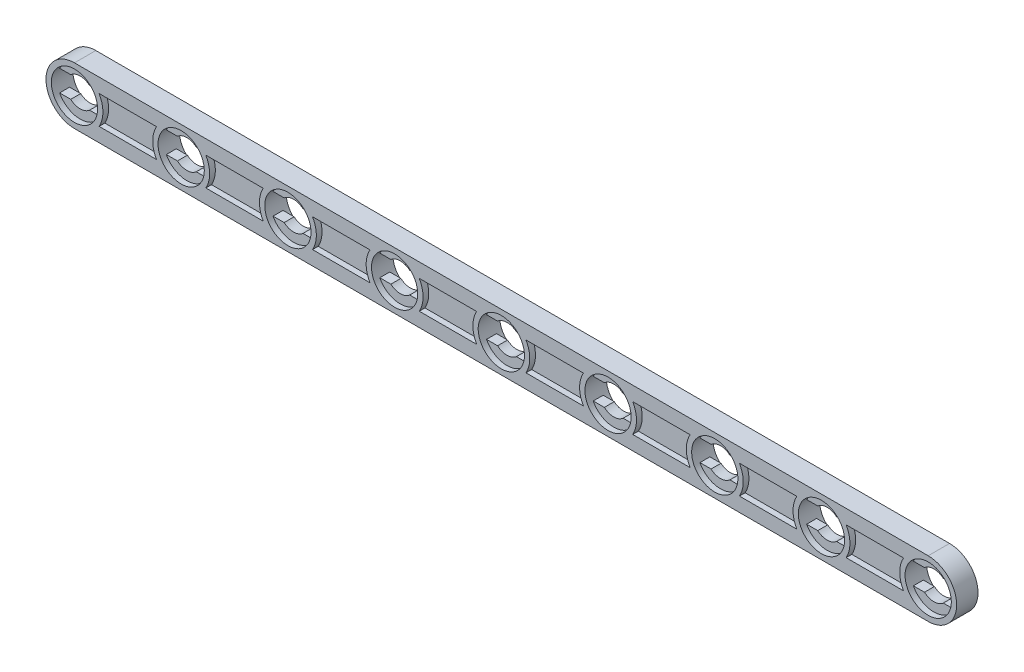
from build123d import *

# Parameters (mm, degrees)
EXTRUDE_1_DEPTH           = 3
CUT_EXTRUDE_1_REACH       = 126.101
SKETCH_3_R                = 3.25
CUT_EXTRUDE_2_DEPTH       = 0.8
CUT_EXTRUDE_START         = -2.2
SKETCH_3_2_R              = 3.25
CUT_EXTRUDE_3_DEPTH       = 0.8
CUT_EXTRUDE_4_DEPTH       = 0.8
SKETCH_5_W                = 7
SKETCH_5_H                = 4
CUT_EXTRUDE_6_DEPTH       = 0.8
MIRROR_8_COPY_1_REACH     = 126.101
MIRROR_8_COPY_2_SKETCH_R  = 3.25
MIRROR_8_COPY_2_DEPTH     = 0.8
MIRROR_START              = -2.2
MIRROR_8_COPY_3_SKETCH_R  = 3.25
MIRROR_8_COPY_3_DEPTH     = 0.8
MIRROR_8_COPY_4_DEPTH     = 0.8
MIRROR_8_COPY_5_SKETCH_W  = 7
MIRROR_8_COPY_5_SKETCH_H  = 4
MIRROR_8_COPY_5_DEPTH     = 0.8
MIRROR_8_COPY_6_REACH     = 126.101
MIRROR_8_COPY_7_SKETCH_R  = 3.25
MIRROR_8_COPY_7_DEPTH     = 0.8
MIRROR_8_COPY_8_SKETCH_R  = 3.25
MIRROR_8_COPY_8_DEPTH     = 0.8
MIRROR_10_COPY_1_REACH    = 126.101
MIRROR_10_COPY_2_SKETCH_R = 3.25
MIRROR_10_COPY_2_DEPTH    = 0.8
MIRROR_10_COPY_3_SKETCH_R = 3.25
MIRROR_10_COPY_3_DEPTH    = 0.8
MIRROR_10_COPY_4_DEPTH    = 0.8
MIRROR_10_COPY_5_SKETCH_W = 7
MIRROR_10_COPY_5_SKETCH_H = 4
MIRROR_10_COPY_5_DEPTH    = 0.8


with BuildPart() as part:
    # 草图1 → 凸台-拉伸1 (new body)
    with BuildSketch(Plane.XY):
        with BuildLine():
            Line((0, 4), (120, 4))
            ThreePointArc((120, 4), (124, 0), (120, -4))
            Line((120, -4), (0, -4))
            ThreePointArc((0, -4), (-4, 0), (0, 4))
        make_face()
    extrude(amount=-EXTRUDE_1_DEPTH)

    # 草图2 → 切除-拉伸1 (cut, up to next)
    with BuildSketch(Plane.XY, mode=Mode.PRIVATE) as cut_extrude_1_sk1:
        with BuildLine():
            Line((1.322875656, -1.5), (2.883140649, -1.5))
            ThreePointArc((2.883140649, -1.5), (3.25, 0), (2.883140649, 1.5))
            Line((2.883140649, 1.5), (1.322875656, 1.5))
            ThreePointArc((1.322875656, 1.5), (0, 2), (-1.322875656, 1.5))
            Line((-1.322875656, 1.5), (-2.883140649, 1.5))
            ThreePointArc((-2.883140649, 1.5), (-3.25, 0), (-2.883140649, -1.5))
            Line((-2.883140649, -1.5), (-1.322875656, -1.5))
            ThreePointArc((-1.322875656, -1.5), (0, -2), (1.322875656, -1.5))
        make_face()
    cut_extrude_1_tool1 = extrude(cut_extrude_1_sk1.sketch, amount=-CUT_EXTRUDE_1_REACH, mode=Mode.PRIVATE) & part.part
    cut_extrude_1 = cut_extrude_1_tool1.solids().sort_by_distance((0, 0, 0))[0]
    add(cut_extrude_1, mode=Mode.SUBTRACT)

    # 草图3 → 切除-拉伸2 (cut)
    with BuildSketch(Plane.XY):
        Circle(SKETCH_3_R)
    cut_extrude_2 = extrude(amount=-CUT_EXTRUDE_2_DEPTH, mode=Mode.SUBTRACT)

    # 草图3<2> → 切除-拉伸3 (cut)
    with BuildSketch(Plane.XY.offset(CUT_EXTRUDE_START)):
        Circle(SKETCH_3_2_R)
    cut_extrude_3 = extrude(amount=-CUT_EXTRUDE_3_DEPTH, mode=Mode.SUBTRACT)

    # 草图4 → 切除-拉伸4 (cut)
    with BuildSketch(Plane.XY):
        with BuildLine():
            Line((3.464101615, 2), (11.535898385, 2))
            ThreePointArc((11.535898385, 2), (11, 0), (11.535898385, -2))
            Line((11.535898385, -2), (3.464101615, -2))
            ThreePointArc((3.464101615, -2), (4, 0), (3.464101615, 2))
        make_face()
    cut_extrude_4 = extrude(amount=-CUT_EXTRUDE_4_DEPTH, mode=Mode.SUBTRACT)

    # 草图5 → 切除-拉伸6 (cut)
    with BuildSketch(Plane(origin=(0, 0, -3), x_dir=(-1, 0, 0), z_dir=(0, 0, -1))):
        with Locations((-7.5, 0)):
            Rectangle(SKETCH_5_W, SKETCH_5_H)
    cut_extrude_6 = extrude(amount=-CUT_EXTRUDE_6_DEPTH, mode=Mode.SUBTRACT)

    # 镜向1: 切除-拉伸1, 切除-拉伸2, 切除-拉伸3 across plane
    add(cut_extrude_1.mirror(Plane(origin=(7.5, 0, 0), x_dir=(0, 0, 1), z_dir=(1, 0, 0))), mode=Mode.SUBTRACT)
    add(cut_extrude_2.mirror(Plane(origin=(7.5, 0, 0), x_dir=(0, 0, 1), z_dir=(1, 0, 0))), mode=Mode.SUBTRACT)
    add(cut_extrude_3.mirror(Plane(origin=(7.5, 0, 0), x_dir=(0, 0, 1), z_dir=(1, 0, 0))), mode=Mode.SUBTRACT)

    # 镜向3: 切除-拉伸4, 切除-拉伸6 across plane
    add(cut_extrude_4.mirror(Plane(origin=(15, 0, 0), x_dir=(0, 0, 1), z_dir=(1, 0, 0))), mode=Mode.SUBTRACT)
    add(cut_extrude_6.mirror(Plane(origin=(15, 0, 0), x_dir=(0, 0, 1), z_dir=(1, 0, 0))), mode=Mode.SUBTRACT)

    # 镜向4: 切除-拉伸4, 切除-拉伸6 across plane
    add(cut_extrude_4.mirror(Plane(origin=(22.5, 0, 0), x_dir=(0, 0, 1), z_dir=(1, 0, 0))), mode=Mode.SUBTRACT)
    add(cut_extrude_6.mirror(Plane(origin=(22.5, 0, 0), x_dir=(0, 0, 1), z_dir=(1, 0, 0))), mode=Mode.SUBTRACT)

    # 镜向7: 切除-拉伸1, 切除-拉伸2, 切除-拉伸3 across plane
    add(cut_extrude_1.mirror(Plane(origin=(15, 0, 0), x_dir=(0, 0, 1), z_dir=(1, 0, 0))), mode=Mode.SUBTRACT)
    add(cut_extrude_2.mirror(Plane(origin=(15, 0, 0), x_dir=(0, 0, 1), z_dir=(1, 0, 0))), mode=Mode.SUBTRACT)
    add(cut_extrude_3.mirror(Plane(origin=(15, 0, 0), x_dir=(0, 0, 1), z_dir=(1, 0, 0))), mode=Mode.SUBTRACT)

    # 镜向8: 切除-拉伸1, 切除-拉伸2, 切除-拉伸3, 切除-拉伸4, 切除-拉伸6 across plane
    add(cut_extrude_1.mirror(Plane(origin=(37.5, 0, 0), x_dir=(0, 0, 1), z_dir=(1, 0, 0))), mode=Mode.SUBTRACT)
    add(cut_extrude_2.mirror(Plane(origin=(37.5, 0, 0), x_dir=(0, 0, 1), z_dir=(1, 0, 0))), mode=Mode.SUBTRACT)
    add(cut_extrude_3.mirror(Plane(origin=(37.5, 0, 0), x_dir=(0, 0, 1), z_dir=(1, 0, 0))), mode=Mode.SUBTRACT)
    add(cut_extrude_4.mirror(Plane(origin=(37.5, 0, 0), x_dir=(0, 0, 1), z_dir=(1, 0, 0))), mode=Mode.SUBTRACT)
    add(cut_extrude_6.mirror(Plane(origin=(37.5, 0, 0), x_dir=(0, 0, 1), z_dir=(1, 0, 0))), mode=Mode.SUBTRACT)

    # 镜向8 copy 1 sketch → 镜向8 copy 1 (cut, up to next)
    with BuildSketch(Plane(origin=(60, 0, 0), x_dir=(1, 0, 0), z_dir=(0, 0, 1)), mode=Mode.PRIVATE) as mirror_8_copy_1_sk1:
        with BuildLine():
            Line((1.322875656, -1.5), (2.883140649, -1.5))
            ThreePointArc((2.883140649, -1.5), (3.25, 0), (2.883140649, 1.5))
            Line((2.883140649, 1.5), (1.322875656, 1.5))
            ThreePointArc((1.322875656, 1.5), (0, 2), (-1.322875656, 1.5))
            Line((-1.322875656, 1.5), (-2.883140649, 1.5))
            ThreePointArc((-2.883140649, 1.5), (-3.25, 0), (-2.883140649, -1.5))
            Line((-2.883140649, -1.5), (-1.322875656, -1.5))
            ThreePointArc((-1.322875656, -1.5), (0, -2), (1.322875656, -1.5))
        make_face()
    mirror_8_copy_1_tool1 = extrude(mirror_8_copy_1_sk1.sketch, amount=-MIRROR_8_COPY_1_REACH, mode=Mode.PRIVATE) & part.part
    add(mirror_8_copy_1_tool1.solids().sort_by_distance((60, 0, 0))[0], mode=Mode.SUBTRACT)

    # 镜向8 copy 2 sketch → 镜向8 copy 2 (cut)
    with BuildSketch(Plane(origin=(60, 0, 0), x_dir=(1, 0, 0), z_dir=(0, 0, 1))):
        Circle(MIRROR_8_COPY_2_SKETCH_R)
    extrude(amount=-MIRROR_8_COPY_2_DEPTH, mode=Mode.SUBTRACT)

    # 镜向8 copy 3 sketch → 镜向8 copy 3 (cut)
    with BuildSketch(Plane(origin=(60, 0, 0), x_dir=(1, 0, 0), z_dir=(0, 0, 1)).offset(MIRROR_START)):
        Circle(MIRROR_8_COPY_3_SKETCH_R)
    extrude(amount=-MIRROR_8_COPY_3_DEPTH, mode=Mode.SUBTRACT)

    # 镜向8 copy 4 sketch → 镜向8 copy 4 (cut)
    with BuildSketch(Plane(origin=(45, 0, 0), x_dir=(1, 0, 0), z_dir=(0, 0, 1))):
        with BuildLine():
            Line((3.464101615, 2), (11.535898385, 2))
            ThreePointArc((11.535898385, 2), (11, 0), (11.535898385, -2))
            Line((11.535898385, -2), (3.464101615, -2))
            ThreePointArc((3.464101615, -2), (4, 0), (3.464101615, 2))
        make_face()
    extrude(amount=-MIRROR_8_COPY_4_DEPTH, mode=Mode.SUBTRACT)

    # 镜向8 copy 5 sketch → 镜向8 copy 5 (cut)
    with BuildSketch(Plane(origin=(45, 0, -3), x_dir=(-1, 0, 0), z_dir=(0, 0, -1))):
        with Locations((-7.5, 0)):
            Rectangle(MIRROR_8_COPY_5_SKETCH_W, MIRROR_8_COPY_5_SKETCH_H)
    extrude(amount=-MIRROR_8_COPY_5_DEPTH, mode=Mode.SUBTRACT)

    # 镜向8 copy 6 sketch → 镜向8 copy 6 (cut, up to next)
    with BuildSketch(Plane(origin=(45, 0, 0), x_dir=(1, 0, 0), z_dir=(0, 0, 1)), mode=Mode.PRIVATE) as mirror_8_copy_6_sk1:
        with BuildLine():
            Line((1.322875656, -1.5), (2.883140649, -1.5))
            ThreePointArc((2.883140649, -1.5), (3.25, 0), (2.883140649, 1.5))
            Line((2.883140649, 1.5), (1.322875656, 1.5))
            ThreePointArc((1.322875656, 1.5), (0, 2), (-1.322875656, 1.5))
            Line((-1.322875656, 1.5), (-2.883140649, 1.5))
            ThreePointArc((-2.883140649, 1.5), (-3.25, 0), (-2.883140649, -1.5))
            Line((-2.883140649, -1.5), (-1.322875656, -1.5))
            ThreePointArc((-1.322875656, -1.5), (0, -2), (1.322875656, -1.5))
        make_face()
    mirror_8_copy_6_tool1 = extrude(mirror_8_copy_6_sk1.sketch, amount=-MIRROR_8_COPY_6_REACH, mode=Mode.PRIVATE) & part.part
    add(mirror_8_copy_6_tool1.solids().sort_by_distance((45, 0, 0))[0], mode=Mode.SUBTRACT)

    # 镜向8 copy 7 sketch → 镜向8 copy 7 (cut)
    with BuildSketch(Plane(origin=(45, 0, 0), x_dir=(1, 0, 0), z_dir=(0, 0, 1))):
        Circle(MIRROR_8_COPY_7_SKETCH_R)
    extrude(amount=-MIRROR_8_COPY_7_DEPTH, mode=Mode.SUBTRACT)

    # 镜向8 copy 8 sketch → 镜向8 copy 8 (cut)
    with BuildSketch(Plane(origin=(45, 0, 0), x_dir=(1, 0, 0), z_dir=(0, 0, 1)).offset(MIRROR_START)):
        Circle(MIRROR_8_COPY_8_SKETCH_R)
    extrude(amount=-MIRROR_8_COPY_8_DEPTH, mode=Mode.SUBTRACT)

    # 镜向9: 切除-拉伸1, 切除-拉伸2, 切除-拉伸3, 切除-拉伸4, 切除-拉伸6 across plane
    add(cut_extrude_1.mirror(Plane(origin=(45, 0, 0), x_dir=(0, 0, 1), z_dir=(1, 0, 0))), mode=Mode.SUBTRACT)
    add(cut_extrude_2.mirror(Plane(origin=(45, 0, 0), x_dir=(0, 0, 1), z_dir=(1, 0, 0))), mode=Mode.SUBTRACT)
    add(cut_extrude_3.mirror(Plane(origin=(45, 0, 0), x_dir=(0, 0, 1), z_dir=(1, 0, 0))), mode=Mode.SUBTRACT)
    add(cut_extrude_4.mirror(Plane(origin=(45, 0, 0), x_dir=(0, 0, 1), z_dir=(1, 0, 0))), mode=Mode.SUBTRACT)
    add(cut_extrude_6.mirror(Plane(origin=(45, 0, 0), x_dir=(0, 0, 1), z_dir=(1, 0, 0))), mode=Mode.SUBTRACT)

    # 镜向10: 切除-拉伸1, 切除-拉伸2, 切除-拉伸3, 切除-拉伸4, 切除-拉伸6 across plane
    add(cut_extrude_1.mirror(Plane(origin=(60, 0, 0), x_dir=(0, 0, 1), z_dir=(1, 0, 0))), mode=Mode.SUBTRACT)
    add(cut_extrude_2.mirror(Plane(origin=(60, 0, 0), x_dir=(0, 0, 1), z_dir=(1, 0, 0))), mode=Mode.SUBTRACT)
    add(cut_extrude_3.mirror(Plane(origin=(60, 0, 0), x_dir=(0, 0, 1), z_dir=(1, 0, 0))), mode=Mode.SUBTRACT)
    add(cut_extrude_4.mirror(Plane(origin=(60, 0, 0), x_dir=(0, 0, 1), z_dir=(1, 0, 0))), mode=Mode.SUBTRACT)
    add(cut_extrude_6.mirror(Plane(origin=(60, 0, 0), x_dir=(0, 0, 1), z_dir=(1, 0, 0))), mode=Mode.SUBTRACT)

    # 镜向10 copy 1 sketch → 镜向10 copy 1 (cut, up to next)
    with BuildSketch(Plane(origin=(105, 0, 0), x_dir=(1, 0, 0), z_dir=(0, 0, 1)), mode=Mode.PRIVATE) as mirror_10_copy_1_sk1:
        with BuildLine():
            Line((1.322875656, -1.5), (2.883140649, -1.5))
            ThreePointArc((2.883140649, -1.5), (3.25, 0), (2.883140649, 1.5))
            Line((2.883140649, 1.5), (1.322875656, 1.5))
            ThreePointArc((1.322875656, 1.5), (0, 2), (-1.322875656, 1.5))
            Line((-1.322875656, 1.5), (-2.883140649, 1.5))
            ThreePointArc((-2.883140649, 1.5), (-3.25, 0), (-2.883140649, -1.5))
            Line((-2.883140649, -1.5), (-1.322875656, -1.5))
            ThreePointArc((-1.322875656, -1.5), (0, -2), (1.322875656, -1.5))
        make_face()
    mirror_10_copy_1_tool1 = extrude(mirror_10_copy_1_sk1.sketch, amount=-MIRROR_10_COPY_1_REACH, mode=Mode.PRIVATE) & part.part
    add(mirror_10_copy_1_tool1.solids().sort_by_distance((105, 0, 0))[0], mode=Mode.SUBTRACT)

    # 镜向10 copy 2 sketch → 镜向10 copy 2 (cut)
    with BuildSketch(Plane(origin=(105, 0, 0), x_dir=(1, 0, 0), z_dir=(0, 0, 1))):
        Circle(MIRROR_10_COPY_2_SKETCH_R)
    extrude(amount=-MIRROR_10_COPY_2_DEPTH, mode=Mode.SUBTRACT)

    # 镜向10 copy 3 sketch → 镜向10 copy 3 (cut)
    with BuildSketch(Plane(origin=(105, 0, 0), x_dir=(1, 0, 0), z_dir=(0, 0, 1)).offset(MIRROR_START)):
        Circle(MIRROR_10_COPY_3_SKETCH_R)
    extrude(amount=-MIRROR_10_COPY_3_DEPTH, mode=Mode.SUBTRACT)

    # 镜向10 copy 4 sketch → 镜向10 copy 4 (cut)
    with BuildSketch(Plane(origin=(90, 0, 0), x_dir=(1, 0, 0), z_dir=(0, 0, 1))):
        with BuildLine():
            Line((3.464101615, 2), (11.535898385, 2))
            ThreePointArc((11.535898385, 2), (11, 0), (11.535898385, -2))
            Line((11.535898385, -2), (3.464101615, -2))
            ThreePointArc((3.464101615, -2), (4, 0), (3.464101615, 2))
        make_face()
    extrude(amount=-MIRROR_10_COPY_4_DEPTH, mode=Mode.SUBTRACT)

    # 镜向10 copy 5 sketch → 镜向10 copy 5 (cut)
    with BuildSketch(Plane(origin=(90, 0, -3), x_dir=(-1, 0, 0), z_dir=(0, 0, -1))):
        with Locations((-7.5, 0)):
            Rectangle(MIRROR_10_COPY_5_SKETCH_W, MIRROR_10_COPY_5_SKETCH_H)
    extrude(amount=-MIRROR_10_COPY_5_DEPTH, mode=Mode.SUBTRACT)


solid = part.part
